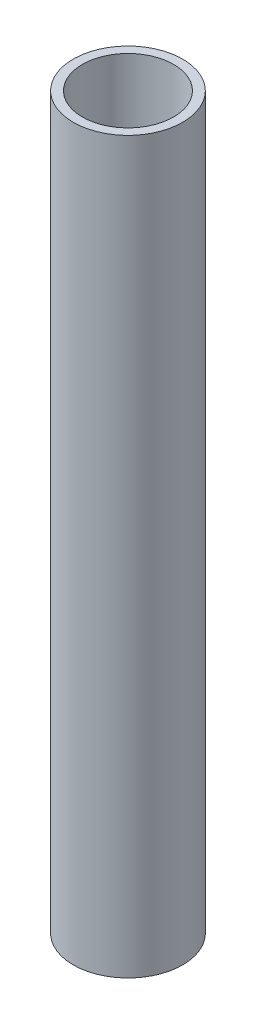
from build123d import *

# Parameters (mm, degrees)
SKETCH1_W          = 15
SKETCH1_H          = 200
SKETCH2_R          = 12.5
CUT_EXTRUDE1_DEPTH = 180


with BuildPart() as part:
    # Sketch1 → Revolve1 (revolve)
    with BuildSketch(Plane.XY, mode=Mode.PRIVATE) as revolve1_sk:
        with Locations((7.5, 100)):
            Rectangle(SKETCH1_W, SKETCH1_H)
    revolve(revolve1_sk.sketch.rotate(Axis((0, 200, 0), (0, -1, 0)), 90), axis=Axis((0, 200, 0), (0, -1, 0)))

    # Sketch2 → Cut-Extrude1 (cut)
    with BuildSketch(Plane(origin=(0, 200, 0), x_dir=(1, 0, 0), z_dir=(0, 1, 0))):
        with Locations(Location((0, 0, 0), (0, 0, 270))):
            Circle(SKETCH2_R)
    extrude(amount=-CUT_EXTRUDE1_DEPTH, mode=Mode.SUBTRACT)


solid = part.part
